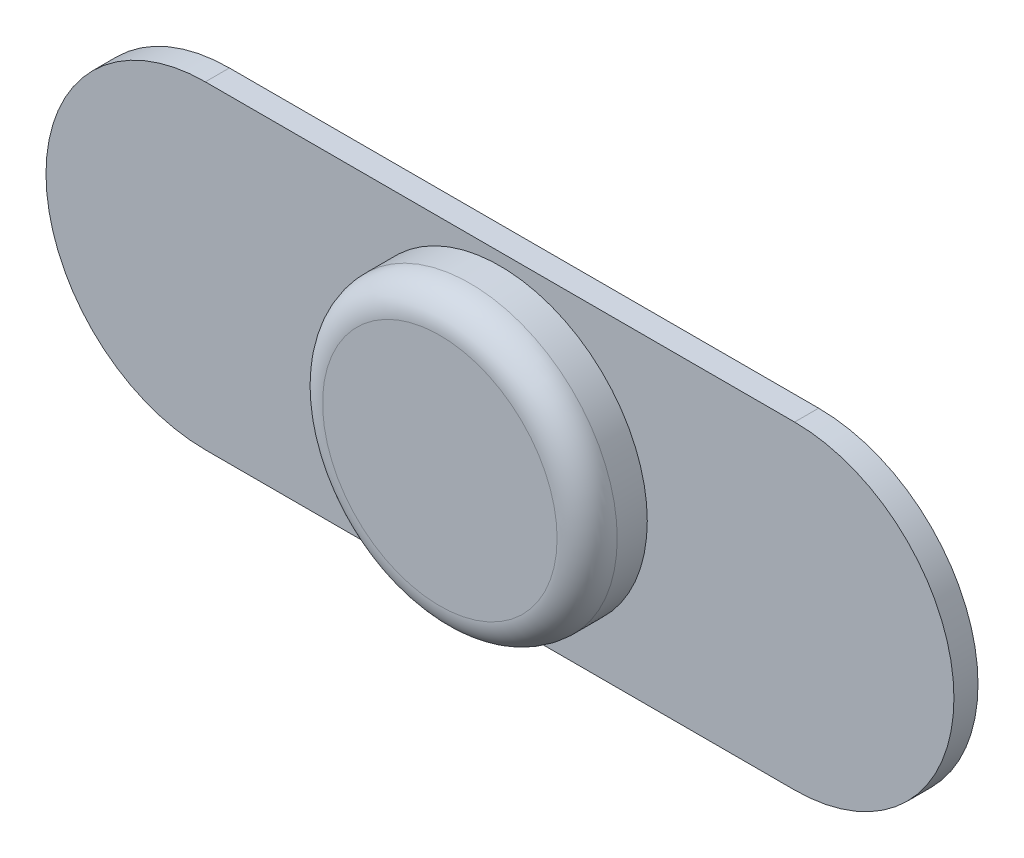
from build123d import *

# Parameters (mm, degrees)
SKIZZE1_R                       = 2.45
AUFSATZ_LINEAR_AUSTRAGEN1_DEPTH = 1
AUFSATZ_LINEAR_AUSTRAGEN2_DEPTH = 0.4
VERRUNDUNG1_R                   = 0.5


with BuildPart() as part:
    # Skizze1 → Aufsatz-Linear austragen1 (new body)
    with BuildSketch(Plane.XY):
        Circle(SKIZZE1_R)
    extrude(amount=AUFSATZ_LINEAR_AUSTRAGEN1_DEPTH)

    # Skizze2 → Aufsatz-Linear austragen2 (add)
    with BuildSketch(Plane(origin=(0, 0, 0), x_dir=(-1, 0, 0), z_dir=(0, 0, -1))):
        with BuildLine():
            Line((-4.9, 2.65), (4.9, 2.65))
            ThreePointArc((4.9, 2.65), (7.55, 0), (4.9, -2.65))
            Line((4.9, -2.65), (-4.9, -2.65))
            ThreePointArc((-4.9, -2.65), (-7.55, 0), (-4.9, 2.65))
        make_face()
    extrude(amount=AUFSATZ_LINEAR_AUSTRAGEN2_DEPTH)

    # Verrundung1
    verrundung1_edges = [part.edges().sort_by_distance(p)[0] for p in [
        (-2.45, 0, 1),
    ]]
    fillet(verrundung1_edges, radius=VERRUNDUNG1_R)


solid = part.part
